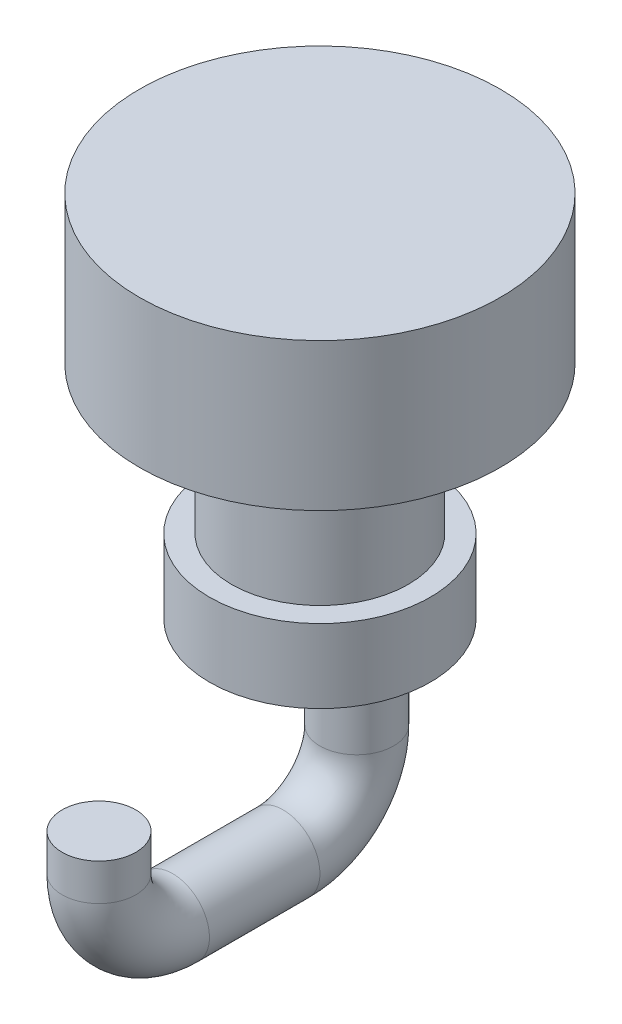
from build123d import *

# Parameters (mm, degrees)
MOAR_SPRINGS_COUNT = 4
SKETCH13_R         = 1.27


with BuildPart() as part:
    # Sketch1 → button body (revolve)
    with BuildSketch(Plane.XY):
        Polygon((0, 0), (6.223, 0), (6.223, -5.08), (3.048, -5.08), (3.048, -10.16), (3.81, -10.16), (3.81, -12.7), (0, -12.7), align=None)
    revolve(axis=Axis((0, -12.7, 0), (0, 1, 0)))


with BuildPart() as moar_springs_1:
    # moar springs: pattern copy
    add(part.part.rotate(Axis((0, 0, 0), (0, -1, 0)), 1 * 360 / MOAR_SPRINGS_COUNT))


with BuildPart() as moar_springs_2:
    # moar springs: pattern copy
    add(part.part.rotate(Axis((0, 0, 0), (0, -1, 0)), 2 * 360 / MOAR_SPRINGS_COUNT))


with BuildPart() as moar_springs_3:
    # moar springs: pattern copy
    add(part.part.rotate(Axis((0, 0, 0), (0, -1, 0)), 3 * 360 / MOAR_SPRINGS_COUNT))


with BuildPart() as part_1:
    add(part.part)

    add(moar_springs_1.part)  # hook for baton merges moar springs_1

    add(moar_springs_2.part)  # hook for baton merges moar springs_2

    add(moar_springs_3.part)  # hook for baton merges moar springs_3
    # hook for baton: sweep along a path in Sketch12
    with BuildLine(Plane(origin=(0, 0, 0), x_dir=(0, 0, -1), z_dir=(1, 0, 0))) as hook_for_baton_path:
        Line((0, -12.7), (0, -16.51))
        ThreePointArc((0, -16.51), (-0.371974388, -17.408025612), (-1.27, -17.78))
        Line((-1.27, -17.78), (-5.08, -17.78))
        ThreePointArc((-5.08, -17.78), (-5.978025612, -17.408025612), (-6.35, -16.51))
        Line((-6.35, -16.51), (-6.35, -15.24))
    # Sketch13 → hook for baton (sweep)
    with BuildSketch(Plane(origin=(0, -12.7, 0), x_dir=(-1, 0, 0), z_dir=(0, -1, 0))):
        with Locations((0, 1.27)):
            Circle(SKETCH13_R)
    sweep(path=hook_for_baton_path.line)


solid = part_1.part
